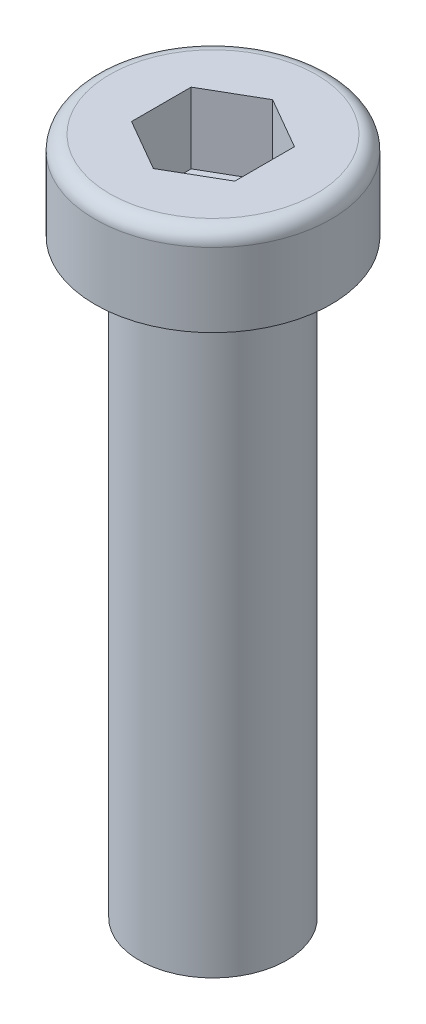
from build123d import *

# Parameters (mm, degrees)
CUT_EXTRUDE1_DEPTH = 4.8


with BuildPart() as part:
    # Sketch1 → Revolve1 (revolve)
    with BuildSketch(Plane.XY, mode=Mode.PRIVATE) as revolve1_sk:
        with BuildLine():
            Line((0, 46), (-7, 46))
            ThreePointArc((-7, 46), (-7.707106781, 45.707106781), (-8, 45))
            Line((-8, 45), (-8, 40))
            Line((-8, 40), (-5, 40))
            Line((-5, 40), (-5, 0))
            Line((-5, 0), (0, 0))
            Line((0, 0), (0, 46))
        make_face()
    revolve(revolve1_sk.sketch.rotate(Axis((0, 0, 0), (0, 1, 0)), 270), axis=Axis((0, 0, 0), (0, 1, 0)))

    # Sketch2 → Cut-Extrude1 (cut)
    with BuildSketch(Plane(origin=(0, 46, 0), x_dir=(1, 0, 0), z_dir=(0, 1, 0))):
        Polygon((0, 4.041451884), (-3.5, 2.020725942), (-3.5, -2.020725942), (0, -4.041451884), (3.5, -2.020725942), (3.5, 2.020725942), align=None)
    extrude(amount=-CUT_EXTRUDE1_DEPTH, mode=Mode.SUBTRACT)


solid = part.part
